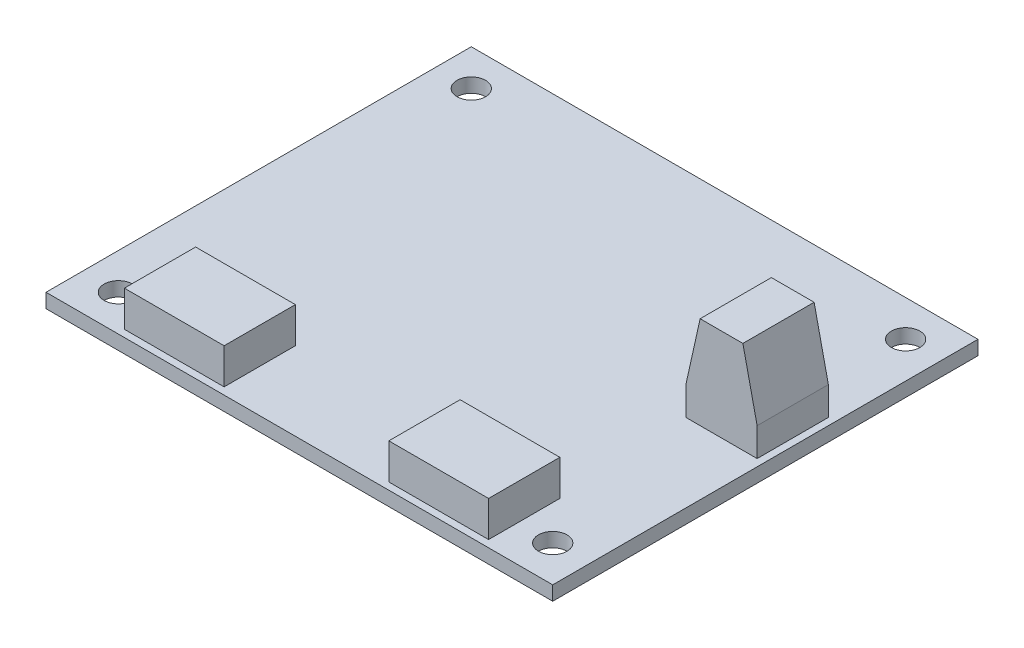
from build123d import *

# Parameters (mm, degrees)
SKETCH1_W           = 71.12
SKETCH1_H           = 59.69
BOSS_EXTRUDE1_DEPTH = 2
SKETCH2_R           = 2
CUT_EXTRUDE1_DEPTH  = 2
SKETCH3_W           = 14
SKETCH3_H           = 10
BOSS_EXTRUDE2_DEPTH = 5
SKETCH4_W           = 10
SKETCH4_H           = 10
BOSS_EXTRUDE3_DEPTH = 13
CUT_EXTRUDE2_DEPTH  = 49.882651319


with BuildPart() as part:
    # Sketch1 → Boss-Extrude1 (new body)
    with BuildSketch(Plane(origin=(0, 0, 0), x_dir=(1, 0, 0), z_dir=(0, 1, 0))):
        Rectangle(SKETCH1_W, SKETCH1_H)
    extrude(amount=BOSS_EXTRUDE1_DEPTH)

    # Sketch2 → Cut-Extrude1 (cut)
    with BuildSketch(Plane(origin=(0, 2, 0), x_dir=(1, 0, 0), z_dir=(0, 1, 0))):
        with Locations(Location((-30.48, 24.765, 0), (0, 0, 270))):
            Circle(SKETCH2_R)
        with Locations(Location((30.48, 24.765, 0), (0, 0, 270))):
            Circle(SKETCH2_R)
        with Locations(Location((30.48, -24.765, 0), (0, 0, 270))):
            Circle(SKETCH2_R)
        with Locations(Location((-30.48, -24.765, 0), (0, 0, 270))):
            Circle(SKETCH2_R)
    extrude(amount=-CUT_EXTRUDE1_DEPTH, mode=Mode.SUBTRACT)

    # Sketch3 → Boss-Extrude2 (add)
    with BuildSketch(Plane(origin=(0, 2, 0), x_dir=(1, 0, 0), z_dir=(0, 1, 0))):
        with Locations((-18.56, -23.845)):
            Rectangle(SKETCH3_W, SKETCH3_H)
        with Locations((18.56, -23.845)):
            Rectangle(SKETCH3_W, SKETCH3_H)
    extrude(amount=BOSS_EXTRUDE2_DEPTH)

    # Sketch4 → Boss-Extrude3 (add)
    with BuildSketch(Plane(origin=(0, 2, 0), x_dir=(1, 0, 0), z_dir=(0, 1, 0))):
        with Locations((29.56, 4.845)):
            Rectangle(SKETCH4_W, SKETCH4_H)
    extrude(amount=BOSS_EXTRUDE3_DEPTH)

    # Sketch7 → Cut-Extrude2 (cut, through all)
    with BuildSketch(Plane.XY.offset(0.155)):
        Polygon((26.56, 15), (24.56, 6), (24.56, 15), align=None)
        Polygon((34.56, 6), (32.56, 15), (34.56, 15), align=None)
    extrude(amount=-CUT_EXTRUDE2_DEPTH, mode=Mode.SUBTRACT)


solid = part.part
